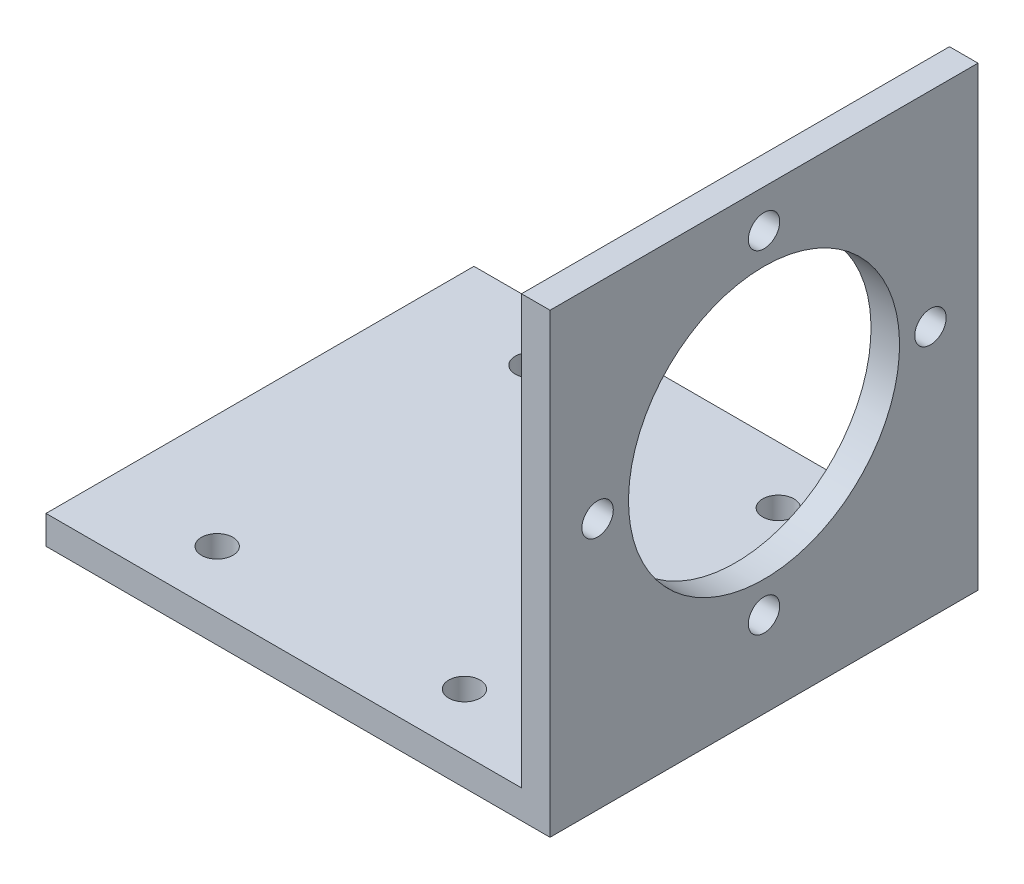
from build123d import *

# Parameters (mm, degrees)
BOSS_EXTRUDE1_DEPTH = 45
M4_TAPPED_HOLE12_D  = 3.3
M4_TAPPED_HOLE13_D  = 3.3
SKETCH23_R          = 14.25
CUT_EXTRUDE5_DEPTH  = 3


with BuildPart() as part:
    # Sketch1 → Boss-Extrude1 (new body)
    with BuildSketch(Plane.XY):
        Polygon((0, 0), (53, 0), (53, 48), (50, 48), (50, 3), (0, 3), align=None)
    extrude(amount=BOSS_EXTRUDE1_DEPTH)

    # M4 Tapped Hole12 (through all)
    with Locations(Plane(origin=(0, 3, 0), x_dir=(1, 0, 0), z_dir=(0, 1, 0))):
        with Locations((38, -39), (12, -39), (12, -6), (38, -6)):
            Hole(M4_TAPPED_HOLE12_D / 2)

    # M4 Tapped Hole13 (through all)
    with Locations(Plane(origin=(53, 0, 0), x_dir=(0, 0, -1), z_dir=(1, 0, 0))):
        with Locations((-22.5, 44), (-5, 26.5), (-22.5, 9), (-40, 26.5)):
            Hole(M4_TAPPED_HOLE13_D / 2)

    # Sketch23 → Cut-Extrude5 (cut)
    with BuildSketch(Plane(origin=(53, 0, 0), x_dir=(0, 0, -1), z_dir=(1, 0, 0))):
        with Locations(Location((-22.5, 26.5, 0), (0, 0, 90))):
            Circle(SKETCH23_R)
    extrude(amount=-CUT_EXTRUDE5_DEPTH, mode=Mode.SUBTRACT)


solid = part.part
